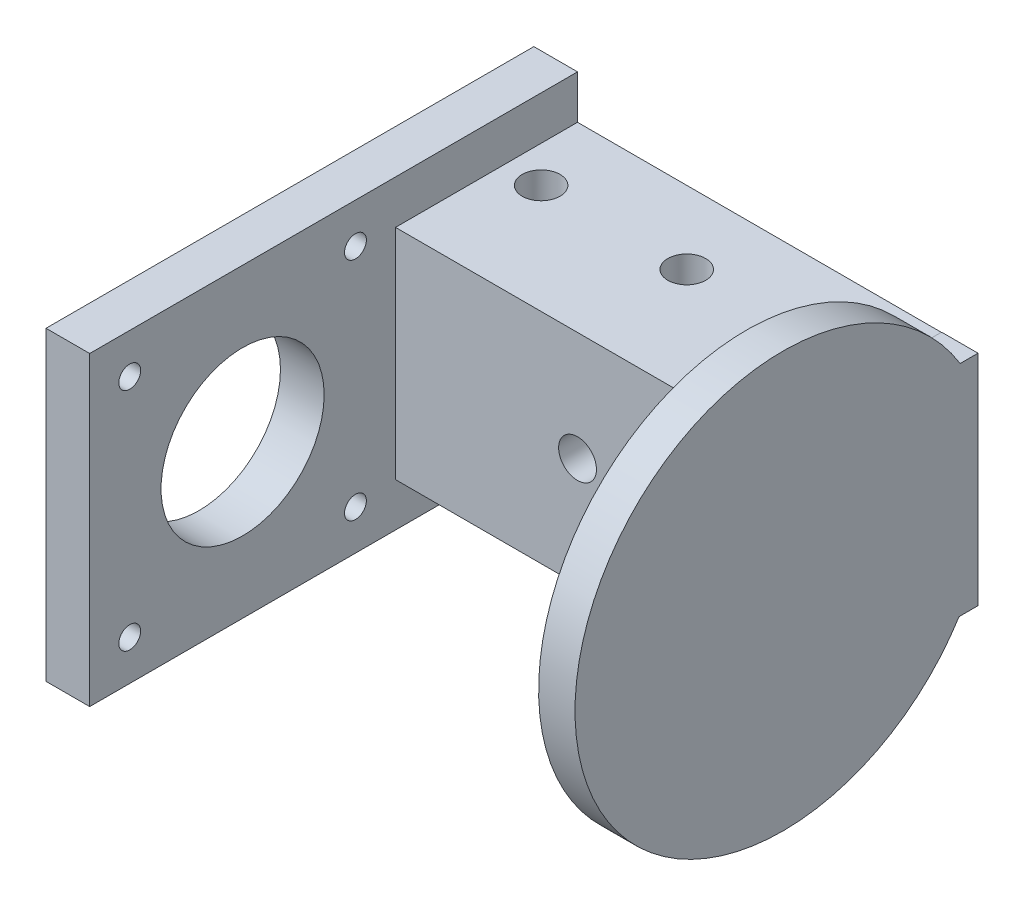
from build123d import *

# Parameters (mm, degrees)
SKETCH1_W           = 67
SKETCH1_H           = 41.999999434
BOSS_EXTRUDE1_DEPTH = 6.000000983
SKETCH2_W           = 24.999999441
SKETCH2_H           = 29.999998398
BOSS_EXTRUDE2_DEPTH = 50
SKETCH3_W           = 19.999999553
SKETCH3_H           = 19.999999553
CUT_EXTRUDE1_DEPTH  = 85.314886613
SKETCH14_R          = 11.2
CUT_EXTRUDE12_DEPTH = 10
SKETCH15_R          = 2.6
CUT_EXTRUDE13_DEPTH = 112.961295121
SKETCH18_R          = 1.5
CUT_EXTRUDE14_DEPTH = 81.454956308
SKETCH19_R          = 2.6
CUT_EXTRUDE15_DEPTH = 113.063962124
SKETCH20_R          = 28.543107088
BOSS_EXTRUDE3_DEPTH = 5
BOSS_EXTRUDE4_REACH = 132.242
SKETCH21_W          = 30.03647221
SKETCH21_H          = 5
SKETCH22_W          = 8.074560758
SKETCH22_H          = 29.943227156
CUT_EXTRUDE16_DEPTH = 10


with BuildPart() as part:
    # Sketch1 → Boss-Extrude1 (new body)
    with BuildSketch(Plane(origin=(45.028056949, 0, 0), x_dir=(0, 0, -1), z_dir=(1, 0, 0))):
        with Locations((-13.500000447, 20.999999717)):
            Rectangle(SKETCH1_W, SKETCH1_H)
    extrude(amount=-BOSS_EXTRUDE1_DEPTH)

    # Sketch2 → Boss-Extrude2 (add)
    with BuildSketch(Plane(origin=(45.028056949, 0, 0), x_dir=(0, 0, -1), z_dir=(1, 0, 0))):
        with Locations((7.499999833, 20.999999251)):
            Rectangle(SKETCH2_W, SKETCH2_H)
    extrude(amount=BOSS_EXTRUDE2_DEPTH)

    # Sketch3 → Cut-Extrude1 (cut, through all)
    with BuildSketch(Plane.ZY.offset(-39.028055966)):
        with Locations((-9.999999777, 20.999999716)):
            Rectangle(SKETCH3_W, SKETCH3_H)
    extrude(amount=-CUT_EXTRUDE1_DEPTH, mode=Mode.SUBTRACT)

    # Sketch14 → Cut-Extrude12 (cut)
    with BuildSketch(Plane(origin=(45.028056949, 0, 0), x_dir=(0, 0, -1), z_dir=(1, 0, 0))):
        with Locations((-25.999999888, 20.999999251)):
            Circle(SKETCH14_R)
    extrude(amount=-CUT_EXTRUDE12_DEPTH, mode=Mode.SUBTRACT)

    # Sketch15 → Cut-Extrude13 (cut, through all)
    with BuildSketch(Plane(origin=(0, 6.000000052, 0), x_dir=(-1, 0, 0), z_dir=(0, -1, 0))):
        with Locations(Location((-50.028056949, 9.999999553, 0), (0, 0, 90))):
            Circle(SKETCH15_R)
        with Locations(Location((-70.028056949, 9.999999553, 0), (0, 0, 90))):
            Circle(SKETCH15_R)
    extrude(amount=-CUT_EXTRUDE13_DEPTH, mode=Mode.SUBTRACT)

    # Sketch18 → Cut-Extrude14 (cut, through all)
    with BuildSketch(Plane(origin=(45.028056949, 0, 0), x_dir=(0, 0, -1), z_dir=(1, 0, 0))):
        with Locations((-10.499999888, 36.499999251)):
            Circle(SKETCH18_R)
        with Locations((-10.499999888, 5.499999251)):
            Circle(SKETCH18_R)
        with Locations((-41.499999888, 5.499999251)):
            Circle(SKETCH18_R)
        with Locations((-41.499999888, 36.499999251)):
            Circle(SKETCH18_R)
    extrude(amount=-CUT_EXTRUDE14_DEPTH, mode=Mode.SUBTRACT)

    # Sketch19 → Cut-Extrude15 (cut, through all)
    with BuildSketch(Plane.XY.offset(4.999999888)):
        with Locations((70.028056949, 20.999999251)):
            Circle(SKETCH19_R)
    extrude(amount=-CUT_EXTRUDE15_DEPTH, mode=Mode.SUBTRACT)

    # Sketch20 → Boss-Extrude3 (add)
    with BuildSketch(Plane(origin=(95.028056949, 0, 0), x_dir=(0, 0, -1), z_dir=(1, 0, 0))):
        with Locations(Location((-6.802134848, 21.140269153, 0), (0, 0, 327.965134835))):
            Circle(SKETCH20_R)
    extrude(amount=BOSS_EXTRUDE3_DEPTH)

    # Sketch21 → Boss-Extrude4 (add, up to next)
    with BuildSketch(Plane.YX.offset(19.999999553), mode=Mode.PRIVATE) as boss_extrude4_sk1:
        with Locations((21.018236157, 97.528056949)):
            Rectangle(SKETCH21_W, SKETCH21_H)
    boss_extrude4_tool1 = extrude(boss_extrude4_sk1.sketch, amount=-BOSS_EXTRUDE4_REACH, mode=Mode.PRIVATE) - part.part
    add(boss_extrude4_tool1.solids().sort_by_distance((97.528057, 21.018236, -20))[0])
    add(boss_extrude4_tool1.solids().sort_by_distance((97.528057, 21.018236, -20))[1])

    # Sketch22 → Cut-Extrude16 (cut)
    with BuildSketch(Plane(origin=(100.028056949, 0, 0), x_dir=(0, 0, -1), z_dir=(1, 0, 0))):
        with Locations((24.037279932, 20.970137181)):
            Rectangle(SKETCH22_W, SKETCH22_H)
    extrude(amount=-CUT_EXTRUDE16_DEPTH, mode=Mode.SUBTRACT)


solid = part.part
